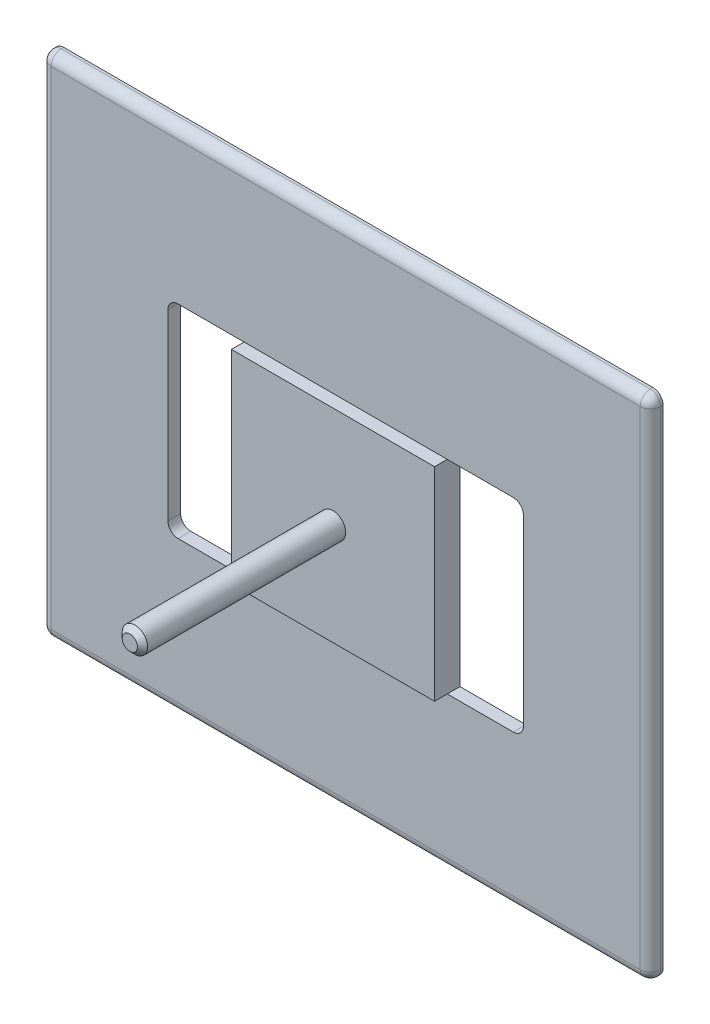
from build123d import *

# Parameters (mm, degrees)
SKETCH1_W           = 120
SKETCH1_H           = 100
SKETCH1_R           = 2.5
BOSS_EXTRUDE1_DEPTH = 5
SKETCH2_R           = 2.5
BOSS_EXTRUDE2_DEPTH = 45
CHAMFER1_SIZE       = 1
SKETCH3_W           = 120
SKETCH3_H           = 100
SKETCH3_W_2         = 40
SKETCH3_H_2         = 40
CUT_EXTRUDE1_DEPTH  = 2.5
SKETCH6_W           = 15
SKETCH6_H           = 40
CUT_EXTRUDE2_DEPTH  = 89.917096219
FILLET1_R           = 2
FILLET2_R           = 2


with BuildPart() as part:
    # Sketch1 → Boss-Extrude1 (new body)
    with BuildSketch(Plane.XY):
        Rectangle(SKETCH1_W, SKETCH1_H)
        Circle(SKETCH1_R, mode=Mode.SUBTRACT)
    extrude(amount=BOSS_EXTRUDE1_DEPTH)

    # Sketch2 → Boss-Extrude2 (add)
    with BuildSketch(Plane.XY):
        with Locations(Location((0, 0, 0), (0, 0, 180))):
            Circle(SKETCH2_R)
    extrude(amount=BOSS_EXTRUDE2_DEPTH)

    # Chamfer1
    chamfer1_edges = [part.edges().sort_by_distance(p)[0] for p in [
        (2.5, 0, 45),
    ]]
    chamfer(chamfer1_edges, length=CHAMFER1_SIZE)

    # Sketch3 → Cut-Extrude1 (cut)
    with BuildSketch(Plane.XY.offset(5)):
        Rectangle(SKETCH3_W, SKETCH3_H)
        Rectangle(SKETCH3_W_2, SKETCH3_H_2, mode=Mode.SUBTRACT)
    extrude(amount=-CUT_EXTRUDE1_DEPTH, mode=Mode.SUBTRACT)

    # Sketch6 → Cut-Extrude2 (cut, through all)
    with BuildSketch(Plane.XY.offset(2.5)):
        with Locations((-27.5, 0)):
            Rectangle(SKETCH6_W, SKETCH6_H)
        with Locations((27.5, 0)):
            Rectangle(SKETCH6_W, SKETCH6_H)
    extrude(amount=-CUT_EXTRUDE2_DEPTH, mode=Mode.SUBTRACT)

    # Fillet1
    fillet1_edges = [part.edges().sort_by_distance(p)[0] for p in [
        (60, -50, 1.25),
        (-60, -50, 1.25),
        (-60, 50, 1.25),
        (60, 50, 1.25),
        (60, 0, 2.5),
        (0, -50, 2.5),
        (-60, 0, 2.5),
        (0, 50, 2.5),
    ]]
    fillet(fillet1_edges, radius=FILLET1_R)

    # Fillet2
    fillet2_edges = [part.edges().sort_by_distance(p)[0] for p in [
        (-35, -20, 1.25),
        (-35, 20, 1.25),
        (35, 20, 1.25),
        (35, -20, 1.25),
    ]]
    fillet(fillet2_edges, radius=FILLET2_R)


solid = part.part
